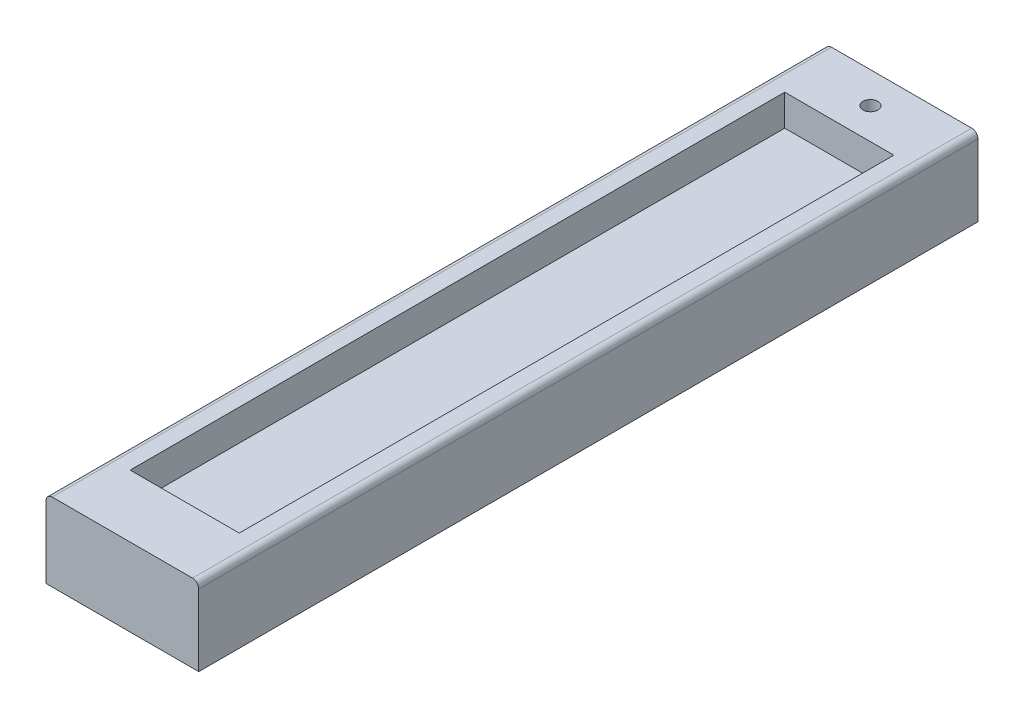
from build123d import *

# Parameters (mm, degrees)
SKETCH1_W               = 49
SKETCH1_H               = 20
BOSS_EXTRUDE1_DEPTH     = 125
SKETCH3_W               = 49
SKETCH3_H               = 250
BOSS_EXTRUDE2_DEPTH     = 5
CUT_EXTRUDE1_DEPTH      = 130.808512818
CUT_EXTRUDE1_DEPTH_BACK = 10
SKETCH2_R               = 2.4
SKETCH5_W               = 35
SKETCH5_H               = 210
CUT_EXTRUDE3_DEPTH      = 10
FILLET1_R               = 2
SKETCH4_R               = 7.874
CUT_EXTRUDE2_DEPTH      = 10


with BuildPart() as part:
    # Sketch1 → Boss-Extrude1 (new, symmetric)
    with BuildSketch(Plane.XY):
        Rectangle(SKETCH1_W, SKETCH1_H)
    extrude(amount=BOSS_EXTRUDE1_DEPTH, both=True)

    # Sketch3 → Boss-Extrude2 (add)
    with BuildSketch(Plane(origin=(0, 10, 0), x_dir=(1, 0, 0), z_dir=(0, 1, 0))):
        Rectangle(SKETCH3_W, SKETCH3_H)
    extrude(amount=BOSS_EXTRUDE2_DEPTH)

    # Sketch2 → Cut-Extrude1 (cut, two sides: drawn at the far end of the back side and taken through both)
    with BuildSketch(Plane(origin=(0, 15, 0), x_dir=(1, 0, 0), z_dir=(0, 1, 0)).offset(-CUT_EXTRUDE1_DEPTH_BACK)):
        with Locations(Location((0, 115, 0), (0, 0, 90))):
            Circle(SKETCH2_R)
    extrude(amount=CUT_EXTRUDE1_DEPTH + CUT_EXTRUDE1_DEPTH_BACK, mode=Mode.SUBTRACT)

    # Sketch5 → Cut-Extrude3 (cut)
    with BuildSketch(Plane(origin=(0, 15, 0), x_dir=(1, 0, 0), z_dir=(0, 1, 0))):
        Rectangle(SKETCH5_W, SKETCH5_H)
    extrude(amount=-CUT_EXTRUDE3_DEPTH, mode=Mode.SUBTRACT)

    # Fillet1
    fillet1_edges = [part.edges().sort_by_distance(p)[0] for p in [
        (-24.5, 15, 0),
        (24.5, 15, 0),
    ]]
    fillet(fillet1_edges, radius=FILLET1_R)

    # Sketch4 → Cut-Extrude2 (cut)
    with BuildSketch(Plane.XZ.offset(10)):
        with Locations(Location((-0.5, 110, 0), (0, 0, 270))):
            Circle(SKETCH4_R)
    extrude(amount=-CUT_EXTRUDE2_DEPTH, mode=Mode.SUBTRACT)


solid = part.part
